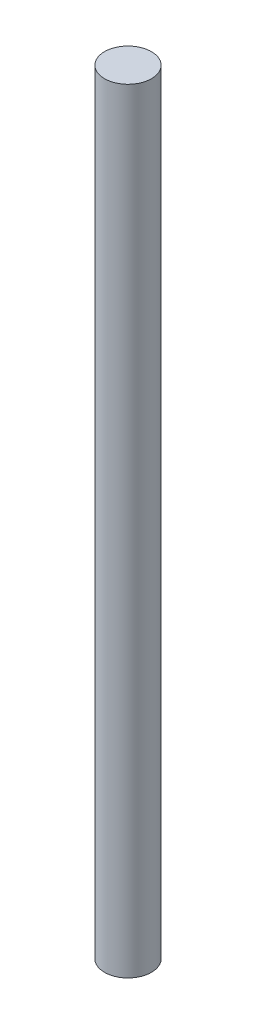
from build123d import *

# Parameters (mm, degrees)
SKETCH1_R           = 5
BOSS_EXTRUDE1_DEPTH = 165


with BuildPart() as part:
    # Sketch1 → Boss-Extrude1 (new body)
    with BuildSketch(Plane(origin=(0, 0, 0), x_dir=(1, 0, 0), z_dir=(0, 1, 0))):
        with Locations(Location((0, 0, 0), (0, 0, 270))):
            Circle(SKETCH1_R)
    extrude(amount=-BOSS_EXTRUDE1_DEPTH)


solid = part.part
